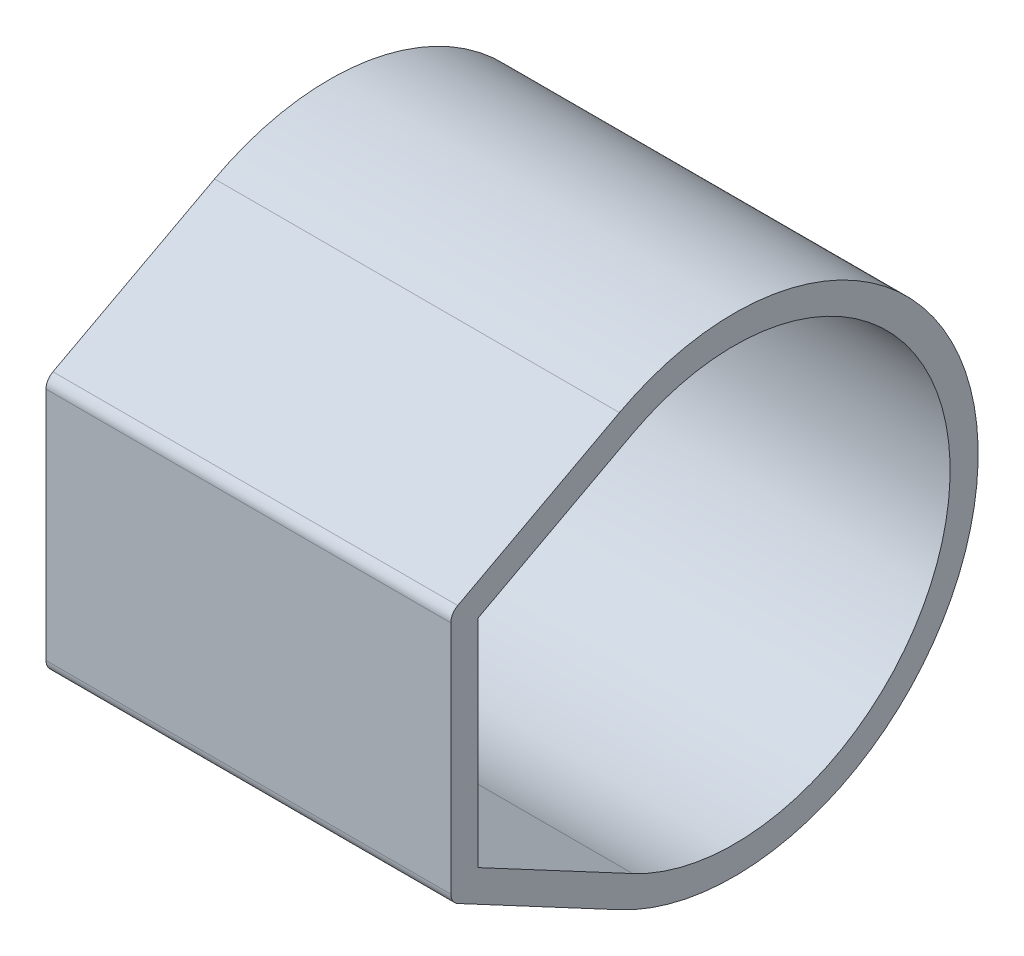
from build123d import *

# Parameters (mm, degrees)
BOSS_EXTRUDE1_DEPTH = 15


with BuildPart() as part:
    # Sketch1 → Boss-Extrude1 (new body)
    with BuildSketch(Plane(origin=(-154.007123162, 0, 0), x_dir=(0, -1, 0), z_dir=(-1, 0, 0))):
        with BuildLine():
            Line((-657.135362842, -373.543546556), (-660.3297369, -367.554095198))
            ThreePointArc((-660.3297369, -367.554095198), (-660.508248633, -367.366340196), (-660.757920333, -367.297185139))
            Line((-660.757920333, -367.297185139), (-669.463950035, -367.297185139))
            ThreePointArc((-669.463950035, -367.297185139), (-669.713621735, -367.366340196), (-669.892133468, -367.554095198))
            Line((-669.892133468, -367.554095198), (-673.086507526, -373.543546556))
            ThreePointArc((-673.086507526, -373.543546556), (-665.110935184, -386.836167126), (-657.135362842, -373.543546556))
        make_face()
        with BuildLine():
            Line((-672.169758714, -374.032479256), (-669.110935184, -368.297185139))
            Line((-669.110935184, -368.297185139), (-661.110935184, -368.297185139))
            Line((-661.110935184, -368.297185139), (-658.052111655, -374.032479256))
            ThreePointArc((-658.052111655, -374.032479256), (-665.110935184, -385.797185139), (-672.169758714, -374.032479256))
        make_face(mode=Mode.SUBTRACT)
    extrude(amount=-BOSS_EXTRUDE1_DEPTH)


solid = part.part
